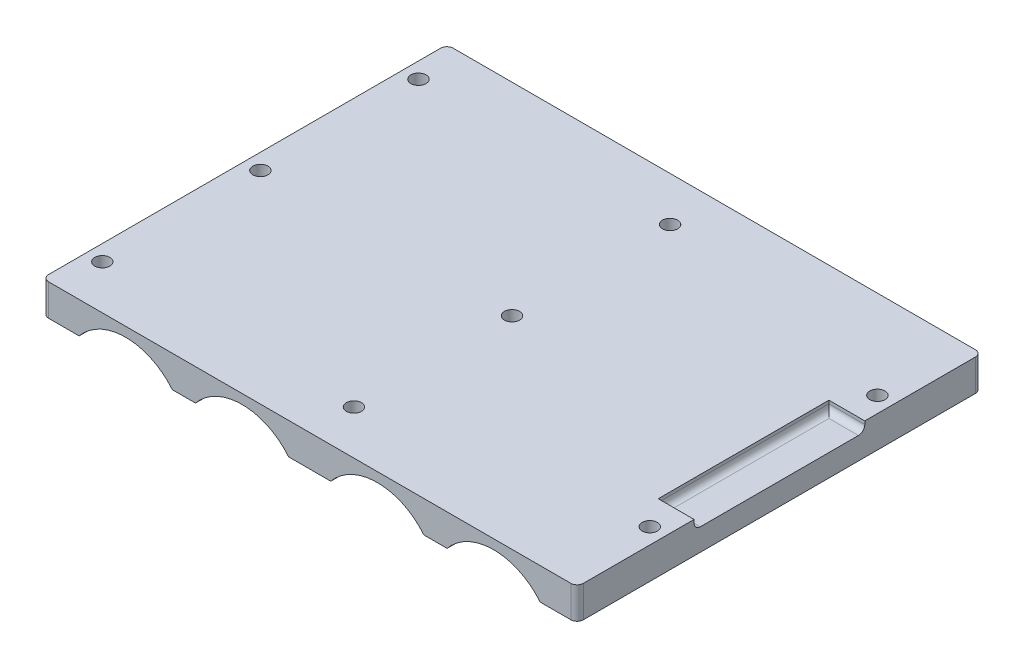
from build123d import *

# Parameters (mm, degrees)
BOSS_EXTRUDE1_DEPTH  = 32
M2_CLEARANCE_HOLE1_D = 2.4
FILLET1_R            = 1
SKETCH9_W            = 5.67
SKETCH9_H            = 27
CUT_EXTRUDE1_DEPTH   = 1.5
FILLET2_R            = 1


with BuildPart() as part:
    # Sketch2 → Boss-Extrude1 (new, symmetric)
    with BuildSketch(Plane.XY):
        with BuildLine():
            Line((3.334540069, -5), (-3.334540069, -5))
            ThreePointArc((-3.334540069, -5), (-10.7, -1.5), (-18.065459931, -5))
            Line((-18.065459931, -5), (-21.734540069, -5))
            ThreePointArc((-21.734540069, -5), (-29.1, -1.5), (-36.465459931, -5))
            Line((-36.465459931, -5), (-42.3, -5))
            Line((-42.3, -5), (-42.3, 0))
            Line((-42.3, 0), (42.3, 0))
            Line((42.3, 0), (42.3, -5))
            Line((42.3, -5), (36.465459931, -5))
            ThreePointArc((36.465459931, -5), (29.1, -1.5), (21.734540069, -5))
            Line((21.734540069, -5), (18.065459931, -5))
            ThreePointArc((18.065459931, -5), (10.7, -1.5), (3.334540069, -5))
        make_face()
    extrude(amount=BOSS_EXTRUDE1_DEPTH, both=True)

    # M2 Clearance Hole1 (through all)
    with Locations(Plane(origin=(0, -5, 0), x_dir=(-1, 0, 0), z_dir=(0, -1, 0))):
        with Locations((0, 25), (0, 0), (0, -25), (39.8, -25), (39.8, 0), (39.8, 25), (-39.8, -18), (-39.8, 18)):
            Hole(M2_CLEARANCE_HOLE1_D / 2)

    # Fillet1
    fillet1_edges = [part.edges().sort_by_distance(p)[0] for p in [
        (42.3, -2.5, -32),
        (-42.3, -2.5, -32),
        (-42.3, -2.5, 32),
        (42.3, -2.5, 32),
    ]]
    fillet(fillet1_edges, radius=FILLET1_R)

    # Sketch9 → Cut-Extrude1 (cut)
    with BuildSketch(Plane(origin=(0, 0, 0), x_dir=(1, 0, 0), z_dir=(0, 1, 0))):
        with Locations((39.465, 0)):
            Rectangle(SKETCH9_W, SKETCH9_H)
    extrude(amount=-CUT_EXTRUDE1_DEPTH, mode=Mode.SUBTRACT)

    # Fillet2
    fillet2_edges = [part.edges().sort_by_distance(p)[0] for p in [
        (39.465, -1.5, 13.5),
        (36.63, -1.5, 0),
        (39.465, -1.5, -13.5),
    ]]
    fillet(fillet2_edges, radius=FILLET2_R)


solid = part.part
